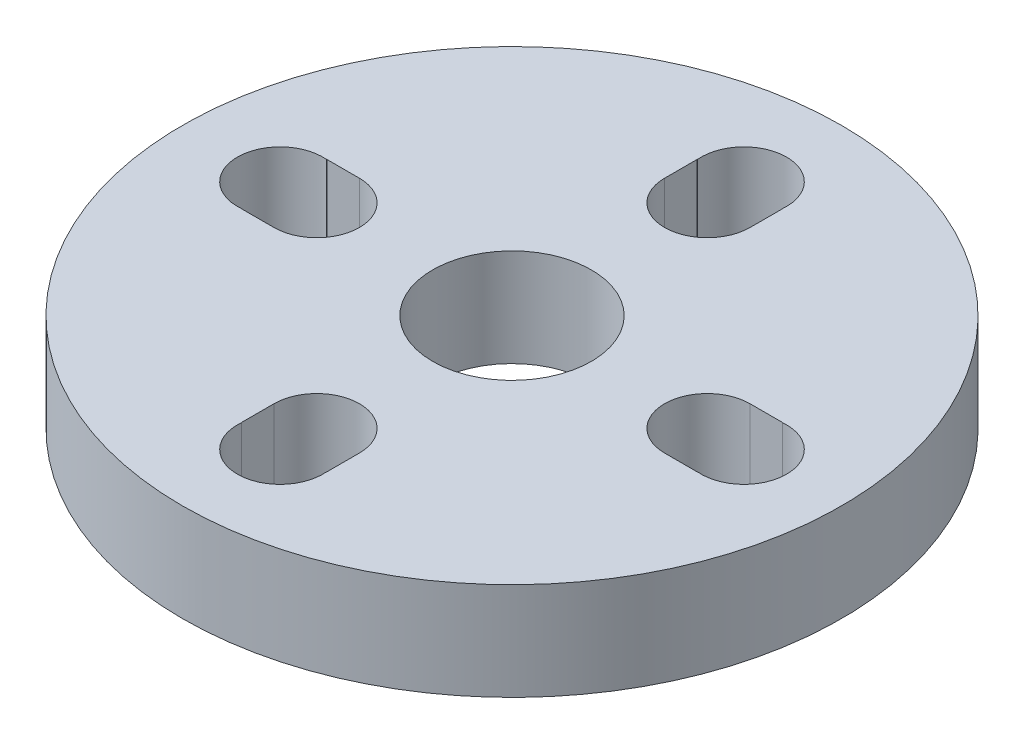
from build123d import *

# Parameters (mm, degrees)
SKETCH1_R           = 13.5
BOSS_EXTRUDE1_DEPTH = 4
CUT_EXTRUDE1_REACH  = 21.506
SKETCH2_R           = 3.25


with BuildPart() as part:
    # Sketch1 → Boss-Extrude1 (new body)
    with BuildSketch(Plane(origin=(0, 0, 0), x_dir=(1, 0, 0), z_dir=(0, 1, 0))):
        with Locations(Location((0, 0, 0), (0, 0, 270))):
            Circle(SKETCH1_R)
    extrude(amount=BOSS_EXTRUDE1_DEPTH)

    # Sketch2 → Cut-Extrude1 (cut, up to next)
    with BuildSketch(Plane(origin=(0, 4, 0), x_dir=(1, 0, 0), z_dir=(0, 1, 0)), mode=Mode.PRIVATE) as cut_extrude1_sk1:
        with BuildLine():
            Line((-9.337424698, -1.75), (-8, -1.75))
            ThreePointArc((-8, -1.75), (-6.25, 0), (-8, 1.75))
            Line((-8, 1.75), (-9.337424698, 1.75))
            ThreePointArc((-9.337424698, 1.75), (-9.338120985, 1.746280755), (-9.338815789, 1.742561233))
            ThreePointArc((-9.338815789, 1.742561233), (-11.25, 0), (-9.338815789, -1.742561233))
            ThreePointArc((-9.338815789, -1.742561233), (-9.338120985, -1.746280755), (-9.337424698, -1.75))
        make_face()
    cut_extrude1_tool1 = extrude(cut_extrude1_sk1.sketch, amount=-CUT_EXTRUDE1_REACH, mode=Mode.PRIVATE) & part.part
    # Sketch2 → Cut-Extrude1 (cut, up to next)
    with BuildSketch(Plane(origin=(0, 4, 0), x_dir=(1, 0, 0), z_dir=(0, 1, 0)), mode=Mode.PRIVATE) as cut_extrude1_sk2:
        with BuildLine():
            ThreePointArc((1.75, 9.337424698), (1.746280755, 9.338120985), (1.742561233, 9.338815789))
            ThreePointArc((1.742561233, 9.338815789), (0, 11.25), (-1.742561233, 9.338815789))
            ThreePointArc((-1.742561233, 9.338815789), (-1.746280755, 9.338120985), (-1.75, 9.337424698))
            Line((-1.75, 9.337424698), (-1.75, 8))
            ThreePointArc((-1.75, 8), (0, 6.25), (1.75, 8))
            Line((1.75, 8), (1.75, 9.337424698))
        make_face()
    cut_extrude1_tool2 = extrude(cut_extrude1_sk2.sketch, amount=-CUT_EXTRUDE1_REACH, mode=Mode.PRIVATE) & part.part
    # Sketch2 → Cut-Extrude1 (cut, up to next)
    with BuildSketch(Plane(origin=(0, 4, 0), x_dir=(1, 0, 0), z_dir=(0, 1, 0)), mode=Mode.PRIVATE) as cut_extrude1_sk3:
        with BuildLine():
            ThreePointArc((-1.742561233, -9.338815789), (0, -11.25), (1.742561233, -9.338815789))
            ThreePointArc((1.742561233, -9.338815789), (1.746280755, -9.338120985), (1.75, -9.337424698))
            Line((1.75, -9.337424698), (1.75, -8))
            ThreePointArc((1.75, -8), (0, -6.25), (-1.75, -8))
            Line((-1.75, -8), (-1.75, -9.337424698))
            ThreePointArc((-1.75, -9.337424698), (-1.746280755, -9.338120985), (-1.742561233, -9.338815789))
        make_face()
    cut_extrude1_tool3 = extrude(cut_extrude1_sk3.sketch, amount=-CUT_EXTRUDE1_REACH, mode=Mode.PRIVATE) & part.part
    # Sketch2 → Cut-Extrude1 (cut, up to next)
    with BuildSketch(Plane(origin=(0, 4, 0), x_dir=(1, 0, 0), z_dir=(0, 1, 0)), mode=Mode.PRIVATE) as cut_extrude1_sk4:
        with BuildLine():
            ThreePointArc((9.337424698, -1.75), (9.338120985, -1.746280755), (9.338815789, -1.742561233))
            ThreePointArc((9.338815789, -1.742561233), (11.25, 0), (9.338815789, 1.742561233))
            ThreePointArc((9.338815789, 1.742561233), (9.338120985, 1.746280755), (9.337424698, 1.75))
            Line((9.337424698, 1.75), (8, 1.75))
            ThreePointArc((8, 1.75), (6.25, 0), (8, -1.75))
            Line((8, -1.75), (9.337424698, -1.75))
        make_face()
    cut_extrude1_tool4 = extrude(cut_extrude1_sk4.sketch, amount=-CUT_EXTRUDE1_REACH, mode=Mode.PRIVATE) & part.part
    # Sketch2 → Cut-Extrude1 (cut, up to next)
    with BuildSketch(Plane(origin=(0, 4, 0), x_dir=(1, 0, 0), z_dir=(0, 1, 0)), mode=Mode.PRIVATE) as cut_extrude1_sk5:
        with Locations(Location((0, 0, 0), (0, 0, 270))):
            Circle(SKETCH2_R)
    cut_extrude1_tool5 = extrude(cut_extrude1_sk5.sketch, amount=-CUT_EXTRUDE1_REACH, mode=Mode.PRIVATE) & part.part
    add(cut_extrude1_tool1.solids().sort_by_distance((-8.749966, 4, 0))[0], mode=Mode.SUBTRACT)
    add(cut_extrude1_tool2.solids().sort_by_distance((0, 4, -8.749966))[0], mode=Mode.SUBTRACT)
    add(cut_extrude1_tool3.solids().sort_by_distance((0, 4, 8.749966))[0], mode=Mode.SUBTRACT)
    add(cut_extrude1_tool4.solids().sort_by_distance((8.749966, 4, 0))[0], mode=Mode.SUBTRACT)
    add(cut_extrude1_tool5.solids().sort_by_distance((0, 4, 0))[0], mode=Mode.SUBTRACT)


solid = part.part
